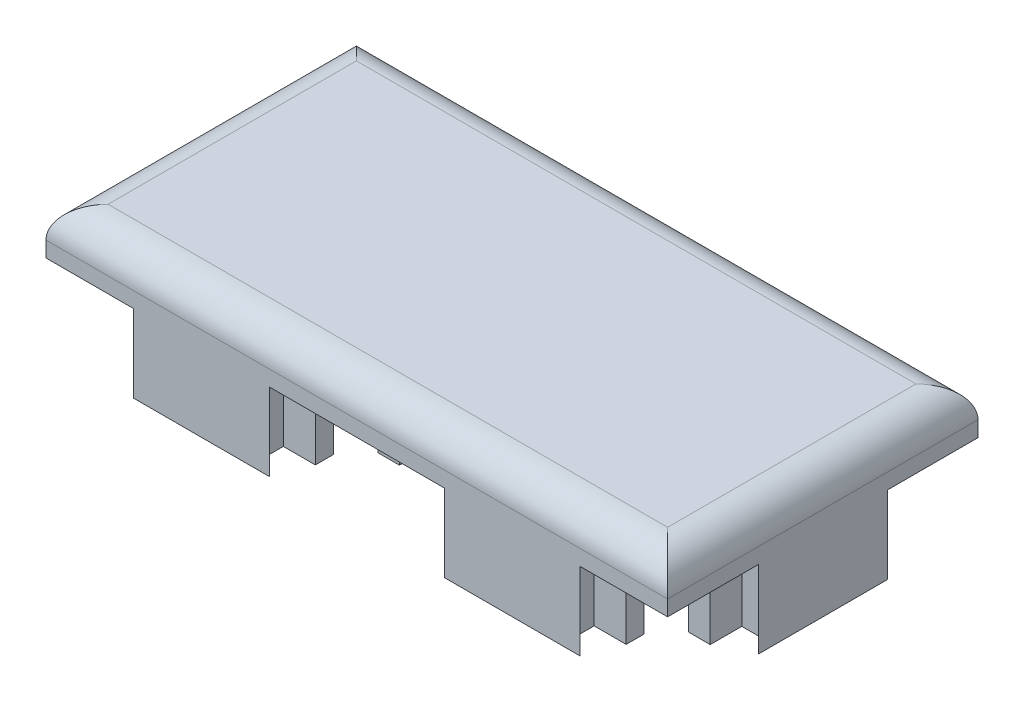
from build123d import *

# Parameters (mm, degrees)
CROQUIS2_R                = 1.779687177
SALIENTE_EXTRUIR1_DEPTH   = 5
SALIENTE_EXTRUIR1_2_DEPTH = 5
SALIENTE_EXTRUIR1_3_DEPTH = 5
SALIENTE_EXTRUIR1_4_DEPTH = 5
SALIENTE_EXTRUIR1_5_DEPTH = 5
SALIENTE_EXTRUIR1_6_DEPTH = 5
SALIENTE_EXTRUIR1_7_DEPTH = 5
SALIENTE_EXTRUIR1_8_DEPTH = 5
SALIENTE_EXTRUIR1_9_DEPTH = 5
CROQUIS3_W                = 40.052022685
CROQUIS3_H                = 20
SALIENTE_EXTRUIR2_DEPTH   = 3
REDONDEO1_R               = 2


with BuildPart() as part:
    # Croquis2 → Saliente-Extruir1 (new body)
    with BuildSketch(Plane(origin=(0, 0, 0), x_dir=(1, 0, 0), z_dir=(0, 1, 0))):
        with Locations(Location((-10.039017014, 0, 0), (0, 0, 90))):
            Circle(CROQUIS2_R)
    extrude(amount=SALIENTE_EXTRUIR1_DEPTH)



with BuildPart() as body_2:
    # Croquis2 → Saliente-Extruir1 2 (new body)
    with BuildSketch(Plane(origin=(0, 0, 0), x_dir=(1, 0, 0), z_dir=(0, 1, 0))):
        with Locations(Location((9.986994329, 0, 0), (0, 0, 270))):
            Circle(CROQUIS2_R)
    extrude(amount=SALIENTE_EXTRUIR1_2_DEPTH)


with BuildPart() as body_3:
    # Croquis2 → Saliente-Extruir1 3 (new body)
    with BuildSketch(Plane(origin=(0, 0, 0), x_dir=(1, 0, 0), z_dir=(0, 1, 0))):
        Polygon((5.614984779, 10), (14.359003879, 10), (13.134466077, 8.775462198), (13.134466077, 7.868577354), (15.198808852, 7.868577354), (15.198808852, 6.711119422), (12.681851378, 4.194161948), (7.292137279, 4.194161948), (4.775179805, 6.711119422), (4.775179805, 7.868577354), (6.839522581, 7.868577354), (6.839522581, 8.775462198), align=None)
    extrude(amount=SALIENTE_EXTRUIR1_3_DEPTH)


with BuildPart() as body_4:
    # Croquis2 → Saliente-Extruir1 4 (new body)
    with BuildSketch(Plane(origin=(0, 0, 0), x_dir=(1, 0, 0), z_dir=(0, 1, 0))):
        Polygon((20, 4.155027818), (20, -4.155027818), (18.985761672, -3.14078949), (17.919495795, -3.14078949), (17.919495795, -5.172992947), (16.531532714, -5.172992947), (14.175115642, -2.816575874), (14.175115642, 2.816575874), (16.531532714, 5.172992947), (17.919495795, 5.172992947), (17.919495795, 3.14078949), (18.985761672, 3.14078949), align=None)
    extrude(amount=SALIENTE_EXTRUIR1_4_DEPTH)


with BuildPart() as body_5:
    # Croquis2 → Saliente-Extruir1 5 (new body)
    with BuildSketch(Plane(origin=(0, 0, 0), x_dir=(1, 0, 0), z_dir=(0, 1, 0))):
        Polygon((-0.026011343, 4.155027818), (-1.040249671, 3.14078949), (-2.106515548, 3.14078949), (-2.106515548, 5.172992947), (-3.494478629, 5.172992947), (-5.850895701, 2.816575874), (-5.850895701, -2.816575874), (-3.494478629, -5.172992947), (-2.106515548, -5.172992947), (-2.106515548, -3.14078949), (-1.040249671, -3.14078949), (-0.026011343, -4.155027818), (0.988226986, -3.14078949), (2.054492862, -3.14078949), (2.054492862, -5.172992947), (3.442455943, -5.172992947), (5.798873016, -2.816575874), (5.798873016, 2.816575874), (3.442455943, 5.172992947), (2.054492862, 5.172992947), (2.054492862, 3.14078949), (0.988226986, 3.14078949), align=None)
    extrude(amount=SALIENTE_EXTRUIR1_5_DEPTH)


with BuildPart() as body_6:
    # Croquis2 → Saliente-Extruir1 6 (new body)
    with BuildSketch(Plane(origin=(0, 0, 0), x_dir=(1, 0, 0), z_dir=(0, 1, 0))):
        Polygon((4.775179805, -6.711119422), (7.292137279, -4.194161948), (12.681851378, -4.194161948), (15.198808852, -6.711119422), (15.198808852, -7.868577354), (13.134466077, -7.868577354), (13.134466077, -8.775462198), (14.359003879, -10), (5.614984779, -10), (6.839522581, -8.775462198), (6.839522581, -7.868577354), (4.775179805, -7.868577354), align=None)
    extrude(amount=SALIENTE_EXTRUIR1_6_DEPTH)


with BuildPart() as body_7:
    # Croquis2 → Saliente-Extruir1 7 (new body)
    with BuildSketch(Plane(origin=(0, 0, 0), x_dir=(1, 0, 0), z_dir=(0, 1, 0))):
        Polygon((-12.733874064, -4.194161948), (-7.344159964, -4.194161948), (-4.82720249, -6.711119422), (-4.82720249, -7.868577354), (-6.891545266, -7.868577354), (-6.891545266, -8.775462198), (-5.667007464, -10), (-14.411026564, -10), (-13.186488762, -8.775462198), (-13.186488762, -7.868577354), (-15.250831538, -7.868577354), (-15.250831538, -6.711119422), align=None)
    extrude(amount=SALIENTE_EXTRUIR1_7_DEPTH)


with BuildPart() as body_8:
    # Croquis2 → Saliente-Extruir1 8 (new body)
    with BuildSketch(Plane(origin=(0, 0, 0), x_dir=(1, 0, 0), z_dir=(0, 1, 0))):
        Polygon((-16.583555399, -5.172992947), (-14.227138327, -2.816575874), (-14.227138327, 2.816575874), (-16.583555399, 5.172992947), (-17.97151848, 5.172992947), (-17.97151848, 3.14078949), (-19.037784357, 3.14078949), (-20.052022685, 4.155027818), (-20.052022685, -4.155027818), (-19.037784357, -3.14078949), (-17.97151848, -3.14078949), (-17.97151848, -5.172992947), align=None)
    extrude(amount=SALIENTE_EXTRUIR1_8_DEPTH)


with BuildPart() as body_9:
    # Croquis2 → Saliente-Extruir1 9 (new body)
    with BuildSketch(Plane(origin=(0, 0, 0), x_dir=(1, 0, 0), z_dir=(0, 1, 0))):
        Polygon((-5.667007464, 10), (-6.891545266, 8.775462198), (-6.891545266, 7.868577354), (-4.82720249, 7.868577354), (-4.82720249, 6.711119422), (-7.344159964, 4.194161948), (-12.733874064, 4.194161948), (-15.250831538, 6.711119422), (-15.250831538, 7.868577354), (-13.186488762, 7.868577354), (-13.186488762, 8.775462198), (-14.411026564, 10), align=None)
    extrude(amount=SALIENTE_EXTRUIR1_9_DEPTH)


with BuildPart() as part_1:
    add(part.part)

    add(body_2.part)  # Saliente-Extruir2 merges body 2

    add(body_3.part)  # Saliente-Extruir2 merges body 3

    add(body_4.part)  # Saliente-Extruir2 merges body 4

    add(body_5.part)  # Saliente-Extruir2 merges body 5

    add(body_6.part)  # Saliente-Extruir2 merges body 6

    add(body_7.part)  # Saliente-Extruir2 merges body 7

    add(body_8.part)  # Saliente-Extruir2 merges body 8

    add(body_9.part)  # Saliente-Extruir2 merges body 9
    # Croquis3 → Saliente-Extruir2 (add)
    with BuildSketch(Plane(origin=(0, 5, 0), x_dir=(1, 0, 0), z_dir=(0, 1, 0))):
        with Locations((-0.026011343, 0)):
            Rectangle(CROQUIS3_W, CROQUIS3_H)
    extrude(amount=SALIENTE_EXTRUIR2_DEPTH)

    # Redondeo1
    redondeo1_edges = [part_1.edges().sort_by_distance(p)[0] for p in [
        (-20.052022685, 8, 0),
        (-0.026011343, 8, 10),
        (20, 8, 0),
        (-0.026011343, 8, -10),
    ]]
    fillet(redondeo1_edges, radius=REDONDEO1_R)


solid = part_1.part
